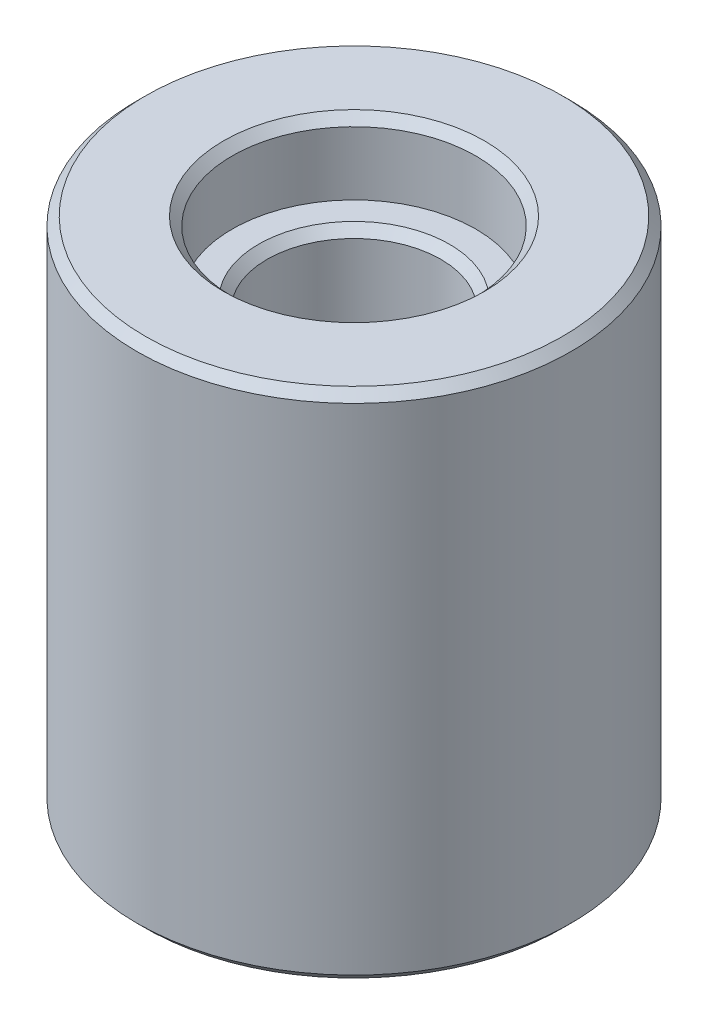
from build123d import *

# Parameters (mm, degrees)
ZKOSEN_1_SIZE   = 1
M6_Z_VIT1_D     = 5
M6_Z_VIT1_DEPTH = 12
M6_Z_VIT1_TIP   = 1.502151548
ZKOSEN_2_SIZE   = 1
ZKOSEN_3_SIZE   = 0.5


with BuildPart() as part:
    # Skica1 → Rotovat1 (revolve)
    with BuildSketch(Plane.XY, mode=Mode.PRIVATE) as rotovat1_sk:
        Polygon((-25, 0), (-25, 59), (-14.025, 59), (-14.025, 50.7), (-10, 50.7), (-10, 11.999895833), (-14.025, 11.999895833), (-14.025, 3.999895833), (-14.6, 3.999895833), (-14.6, 2.699895833), (-13.975, 2.699895833), (-13.975, 0), align=None)
    revolve(rotovat1_sk.sketch.rotate(Axis((0, 0, 0), (0, -1, 0)), 270), axis=Axis((0, 0, 0), (0, -1, 0)))

    # Zkosení1
    zkosen_1_edges = [part.edges().sort_by_distance(p)[0] for p in [
        (0, 11.999895833, -10),
        (0, 50.7, -10),
        (0, 59, -14.025),
        (0, 0, -13.975),
    ]]
    chamfer(zkosen_1_edges, length=ZKOSEN_1_SIZE)

    # M6 závit1
    with Locations(Plane(origin=(0, 0, 0), x_dir=(-1, 0, 0), z_dir=(0, -1, 0))):
        with Locations((0, 19.5), (19.5, 0), (0, -19.5), (-19.5, 0)):
            Hole(M6_Z_VIT1_D / 2, depth=M6_Z_VIT1_DEPTH)
            with Locations((0, 0, -(M6_Z_VIT1_DEPTH + M6_Z_VIT1_TIP / 2))):  # 118° drill point
                Cone(0, M6_Z_VIT1_D / 2, M6_Z_VIT1_TIP, mode=Mode.SUBTRACT)

    # Zkosení2
    zkosen_2_edges = [part.edges().sort_by_distance(p)[0] for p in [
        (0, 59, -25),
        (0, 0, -25),
    ]]
    chamfer(zkosen_2_edges, length=ZKOSEN_2_SIZE)

    # Zkosení3
    zkosen_3_edges = [part.edges().sort_by_distance(p)[0] for p in [
        (17, 0, 0),
        (-2.5, 0, 19.5),
        (-22, 0, 0),
        (-2.5, 0, -19.5),
    ]]
    chamfer(zkosen_3_edges, length=ZKOSEN_3_SIZE)


solid = part.part
